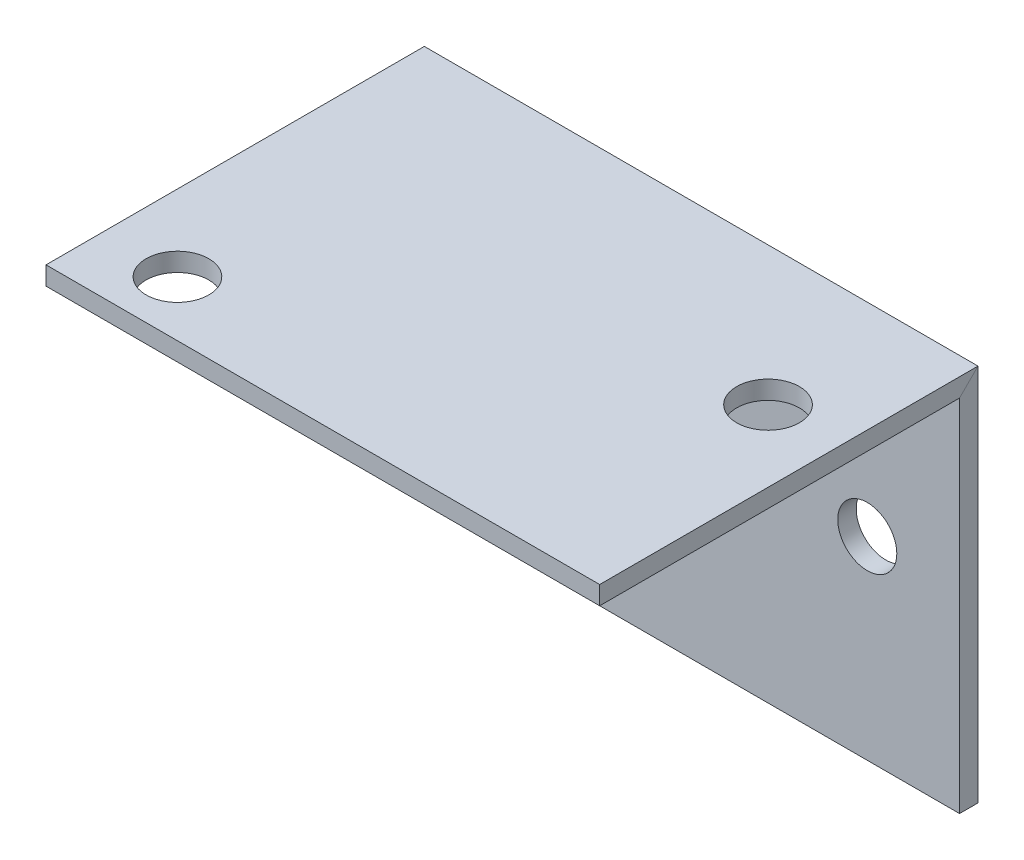
from build123d import *

# Parameters (mm, degrees)
ESQUISSE1_W             = 30
ESQUISSE1_H             = 1
ESQUISSE7_R             = 1.7
ENL_V_MAT_EXTRU_1_DEPTH = 33.023428923
ESQUISSE8_R             = 1.6
ENL_V_MAT_EXTRU_2_DEPTH = 32.705677725


with BuildPart() as part:
    # Balayage1: sweep along a path in Esquisse6
    with BuildLine(Plane(origin=(0, 0, 0), x_dir=(0, 0, -1), z_dir=(1, 0, 0))) as balayage1_path:
        Line((0, 0), (20, 0))
        Line((20, 0), (20, -20))
    # Esquisse1 → Balayage1 (sweep)
    with BuildSketch(Plane.XY):
        Rectangle(ESQUISSE1_W, ESQUISSE1_H)
    sweep(path=balayage1_path.line, transition=Transition.RIGHT)

    # Esquisse7 → Enlèv. mat.-Extru.1 (cut, through all)
    with BuildSketch(Plane.XZ.offset(0.5)):
        with Locations(Location((-10.877296978, -3, 0), (0, 0, 270))):
            Circle(ESQUISSE7_R)
        with Locations(Location((11.122703022, -13, 0), (0, 0, 270))):
            Circle(ESQUISSE7_R)
    extrude(amount=-ENL_V_MAT_EXTRU_1_DEPTH, mode=Mode.SUBTRACT)

    # Esquisse8 → Enlèv. mat.-Extru.2 (cut, through all)
    with BuildSketch(Plane.XY.offset(-19.5)):
        with Locations((10, -9.5)):
            Circle(ESQUISSE8_R)
        with Locations(Location((-10, -9.5, 0), (0, 0, 180))):
            Circle(ESQUISSE8_R)
    extrude(amount=-ENL_V_MAT_EXTRU_2_DEPTH, mode=Mode.SUBTRACT)


solid = part.part
